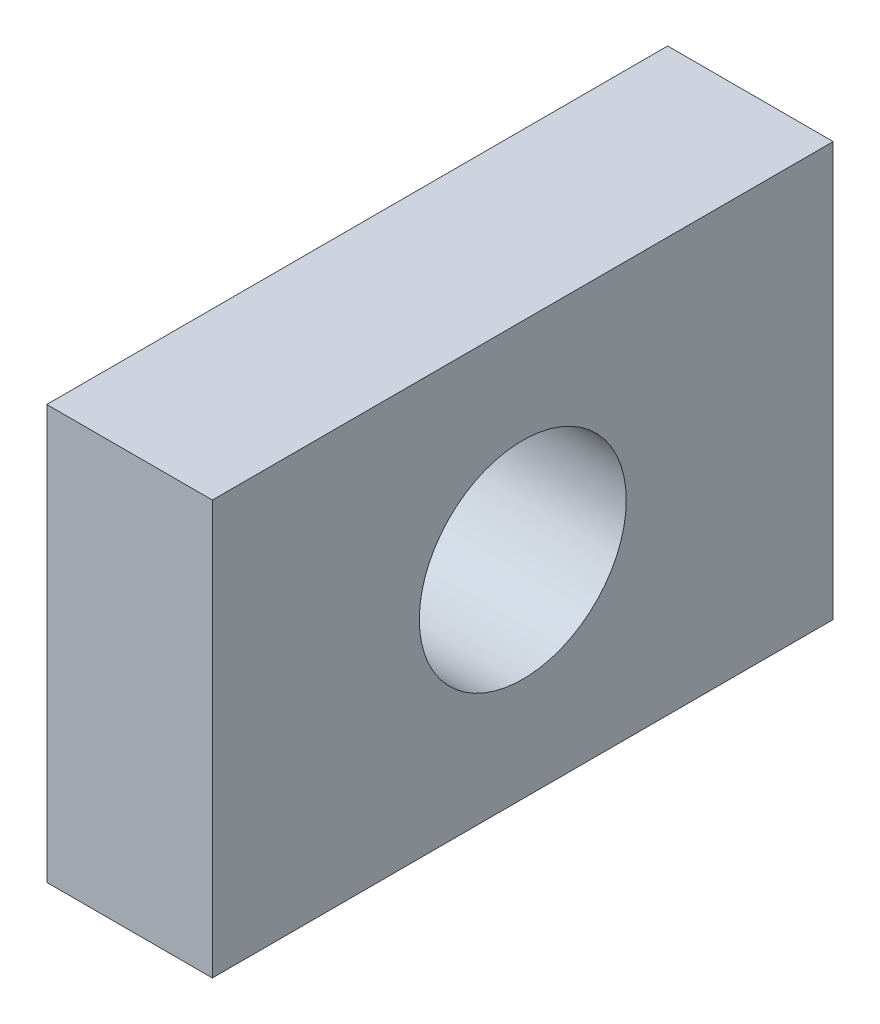
from build123d import *

# Parameters (mm, degrees)
SKETCH1_W           = 150
SKETCH1_H           = 100
SKETCH1_R           = 25
BOSS_EXTRUDE1_DEPTH = 40


with BuildPart() as part:
    # Sketch1 → Boss-Extrude1 (new body)
    with BuildSketch(Plane(origin=(0, 0, 0), x_dir=(0, 0, -1), z_dir=(1, 0, 0))):
        Rectangle(SKETCH1_W, SKETCH1_H)
        Circle(SKETCH1_R, mode=Mode.SUBTRACT)
    extrude(amount=BOSS_EXTRUDE1_DEPTH)


solid = part.part
